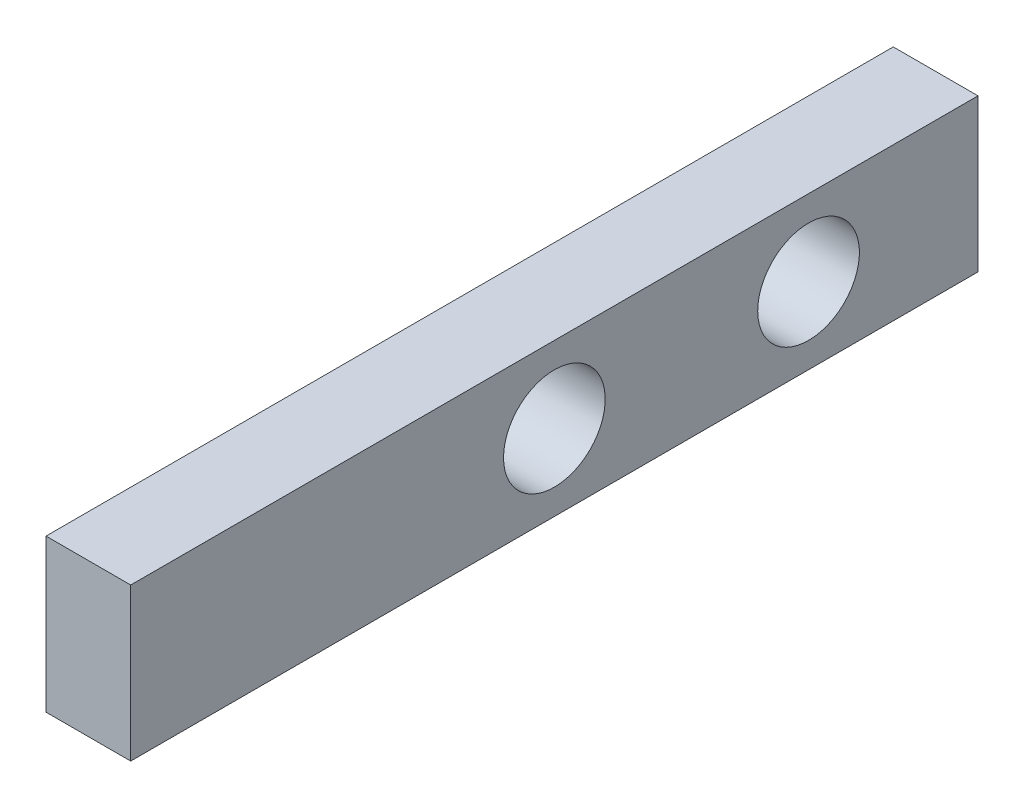
from build123d import *

# Parameters (mm, degrees)
STOP_PLATE_BLANK_SKETCH_W    = 2
STOP_PLATE_BLANK_SKETCH_H    = 3.6
STOP_PLATE_BLANK_DEPTH       = 20
M2_STOP_CLEARANCE_1_SKETCH_R = 1.2
M2_STOP_CLEARANCE_1_DEPTH    = 2.2
M2_STOP_CLEARANCE_2_SKETCH_R = 1.2
M2_STOP_CLEARANCE_2_DEPTH    = 2.2


with BuildPart() as part:
    # Stop plate blank sketch → Stop plate blank (new body)
    with BuildSketch(Plane.XY.offset(-38)):
        with Locations((24.708348754, -61.4)):
            Rectangle(STOP_PLATE_BLANK_SKETCH_W, STOP_PLATE_BLANK_SKETCH_H)
    extrude(amount=STOP_PLATE_BLANK_DEPTH)

    # M2 stop clearance 1 sketch → M2 stop clearance 1 (cut)
    with BuildSketch(Plane(origin=(23.608348754, 0, 0), x_dir=(0, 0, -1), z_dir=(1, 0, 0))):
        with Locations(Location((34, -61.4, 0), (0, 0, 180))):
            Circle(M2_STOP_CLEARANCE_1_SKETCH_R)
    extrude(amount=M2_STOP_CLEARANCE_1_DEPTH, mode=Mode.SUBTRACT)

    # M2 stop clearance 2 sketch → M2 stop clearance 2 (cut)
    with BuildSketch(Plane(origin=(23.608348754, 0, 0), x_dir=(0, 0, -1), z_dir=(1, 0, 0))):
        with Locations(Location((28, -61.4, 0), (0, 0, 180))):
            Circle(M2_STOP_CLEARANCE_2_SKETCH_R)
    extrude(amount=M2_STOP_CLEARANCE_2_DEPTH, mode=Mode.SUBTRACT)


solid = part.part
